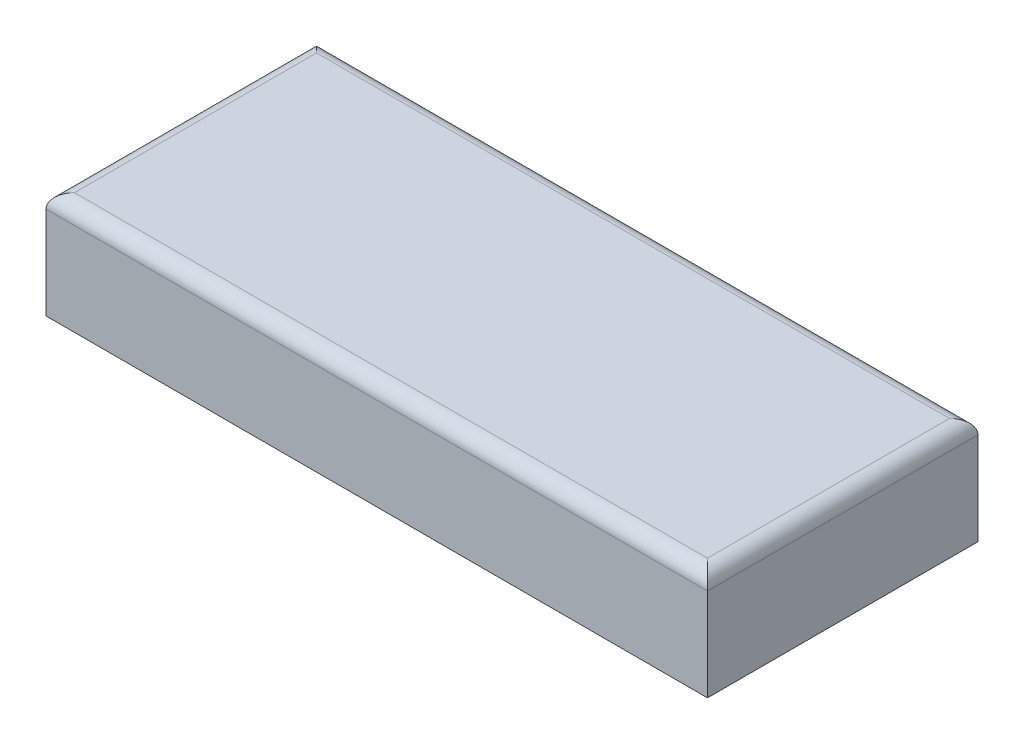
from build123d import *

# Parameters (mm, degrees)
SKETCH2_W           = 118.023469291
SKETCH2_H           = 19.05
BOSS_EXTRUDE1_DEPTH = 48.26
SKETCH24_W          = 114.3
SKETCH24_H          = 43.18
CUT_EXTRUDE2_DEPTH  = 17.78
SKETCH25_W          = 12.7
SKETCH25_H          = 6.35
CUT_EXTRUDE3_DEPTH  = 6.604
FILLET1_R           = 2.54


with BuildPart() as part:
    # Sketch2 → Boss-Extrude1 (new body)
    with BuildSketch(Plane.XY):
        with Locations((59.011734646, 15.875)):
            Rectangle(SKETCH2_W, SKETCH2_H)
    extrude(amount=BOSS_EXTRUDE1_DEPTH)

    # Sketch24 → Cut-Extrude2 (cut)
    with BuildSketch(Plane(origin=(0, 6.35, 0), x_dir=(-1, 0, 0), z_dir=(0, -1, 0))):
        with Locations((-59.026642295, -23.975075688)):
            Rectangle(SKETCH24_W, SKETCH24_H)
    extrude(amount=-CUT_EXTRUDE2_DEPTH, mode=Mode.SUBTRACT)

    # Sketch25 → Cut-Extrude3 (cut)
    with BuildSketch(Plane.ZY):
        with Locations((24.105050581, 15.863147592)):
            Rectangle(SKETCH25_W, SKETCH25_H)
    extrude(amount=-CUT_EXTRUDE3_DEPTH, mode=Mode.SUBTRACT)

    # Fillet1
    fillet1_edges = [part.edges().sort_by_distance(p)[0] for p in [
        (59.011734646, 25.4, 48.26),
        (59.011734646, 25.4, 0),
        (0, 25.4, 24.13),
        (118.023469291, 25.4, 24.13),
    ]]
    fillet(fillet1_edges, radius=FILLET1_R)


solid = part.part
